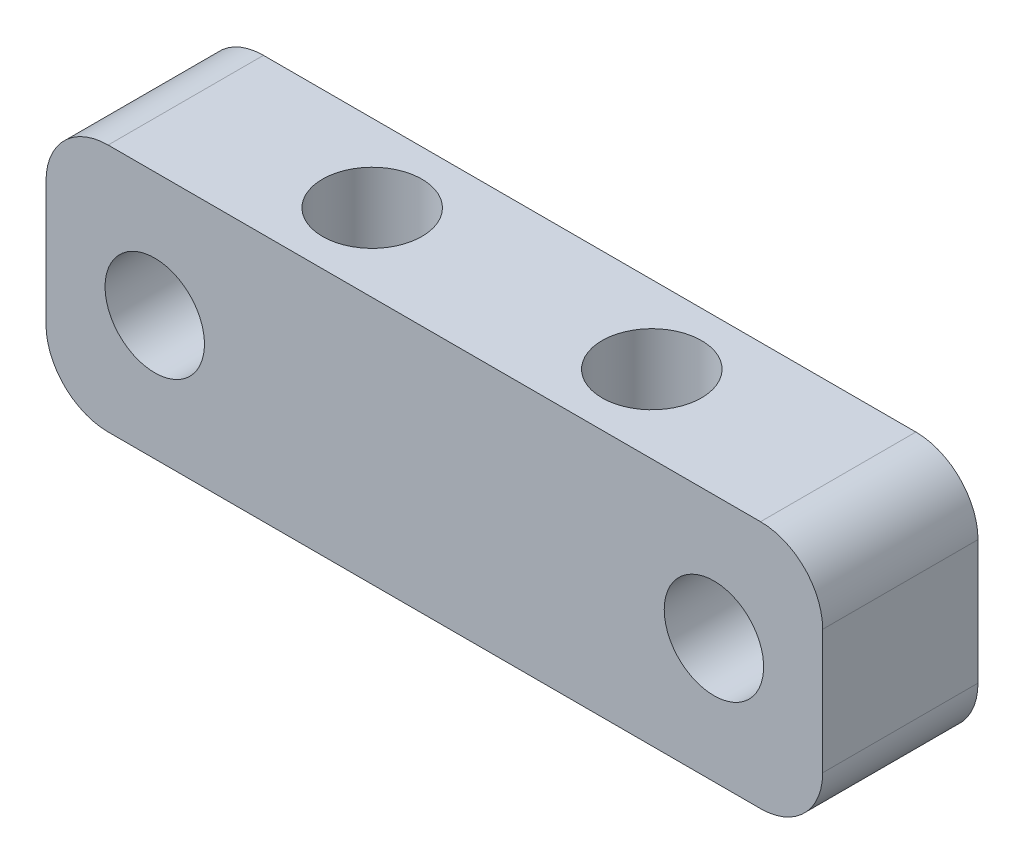
from build123d import *

# Parameters (mm, degrees)
SKETCH1_W           = 25
SKETCH1_H           = 5
SKETCH1_R           = 1.6
BOSS_EXTRUDE1_DEPTH = 8
SKETCH2_R           = 1.6
CUT_EXTRUDE1_DEPTH  = 8
FILLET1_R           = 2


with BuildPart() as part:
    # Sketch1 → Boss-Extrude1 (new body)
    with BuildSketch(Plane(origin=(0, 0, 0), x_dir=(1, 0, 0), z_dir=(0, 1, 0))):
        with Locations((12.5, 2.5)):
            Rectangle(SKETCH1_W, SKETCH1_H)
        with Locations(Location((8, 2.5, 0), (0, 0, 270))):
            Circle(SKETCH1_R, mode=Mode.SUBTRACT)
        with Locations(Location((17, 2.5, 0), (0, 0, 270))):
            Circle(SKETCH1_R, mode=Mode.SUBTRACT)
    extrude(amount=BOSS_EXTRUDE1_DEPTH)

    # Sketch2 → Cut-Extrude1 (cut)
    with BuildSketch(Plane(origin=(0, 0, -5), x_dir=(-1, 0, 0), z_dir=(0, 0, -1))):
        with Locations((-21.5, 4)):
            Circle(SKETCH2_R)
        with Locations((-3.5, 4)):
            Circle(SKETCH2_R)
    extrude(amount=-CUT_EXTRUDE1_DEPTH, mode=Mode.SUBTRACT)

    # Fillet1
    fillet1_edges = [part.edges().sort_by_distance(p)[0] for p in [
        (25, 8, -2.5),
        (0, 8, -2.5),
        (25, 0, -2.5),
        (0, 0, -2.5),
    ]]
    fillet(fillet1_edges, radius=FILLET1_R)


solid = part.part
